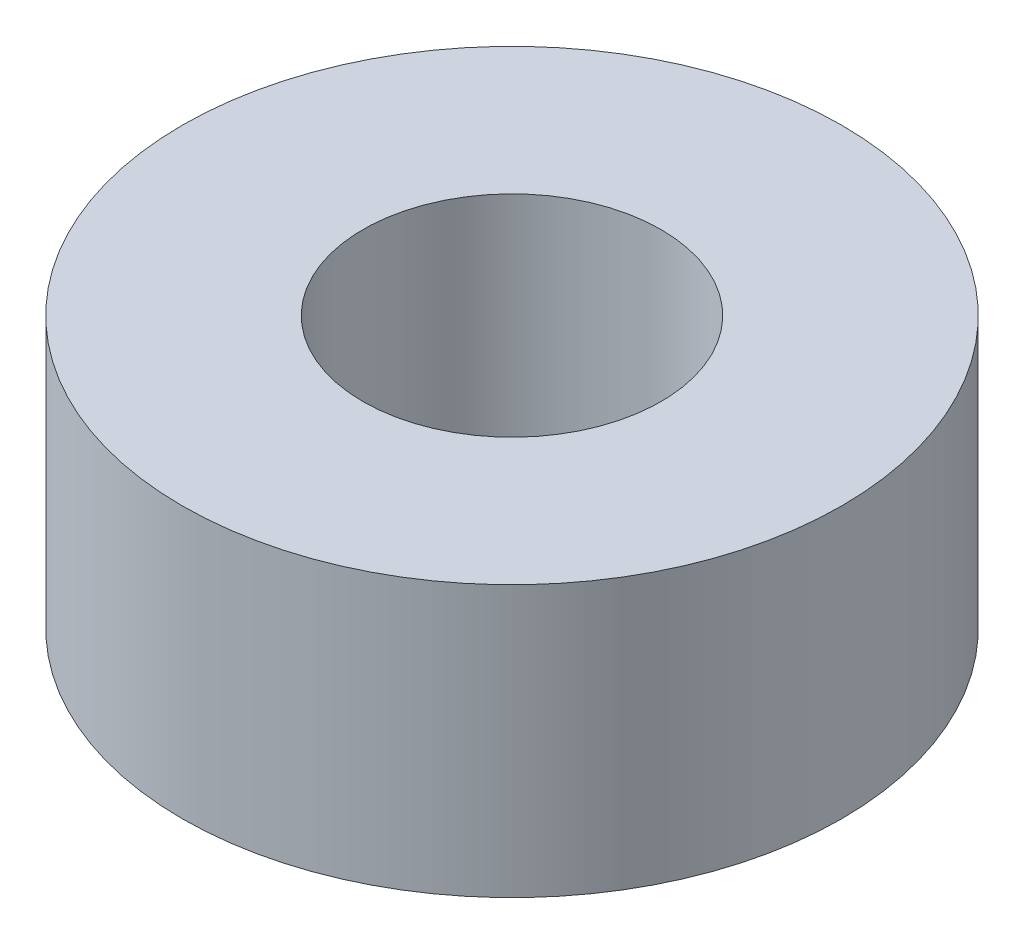
from build123d import *

# Parameters (mm, degrees)
SKETCH1_R           = 3.65
SKETCH1_R_2         = 1.65
BOSS_EXTRUDE1_DEPTH = 3


with BuildPart() as part:
    # Sketch1 → Boss-Extrude1 (new body)
    with BuildSketch(Plane(origin=(0, 0, 0), x_dir=(1, 0, 0), z_dir=(0, 1, 0))):
        with Locations(Location((0, 0, 0), (0, 0, 270))):
            Circle(SKETCH1_R)
        with Locations(Location((0, 0, 0), (0, 0, 270))):
            Circle(SKETCH1_R_2, mode=Mode.SUBTRACT)
    extrude(amount=BOSS_EXTRUDE1_DEPTH)


solid = part.part
